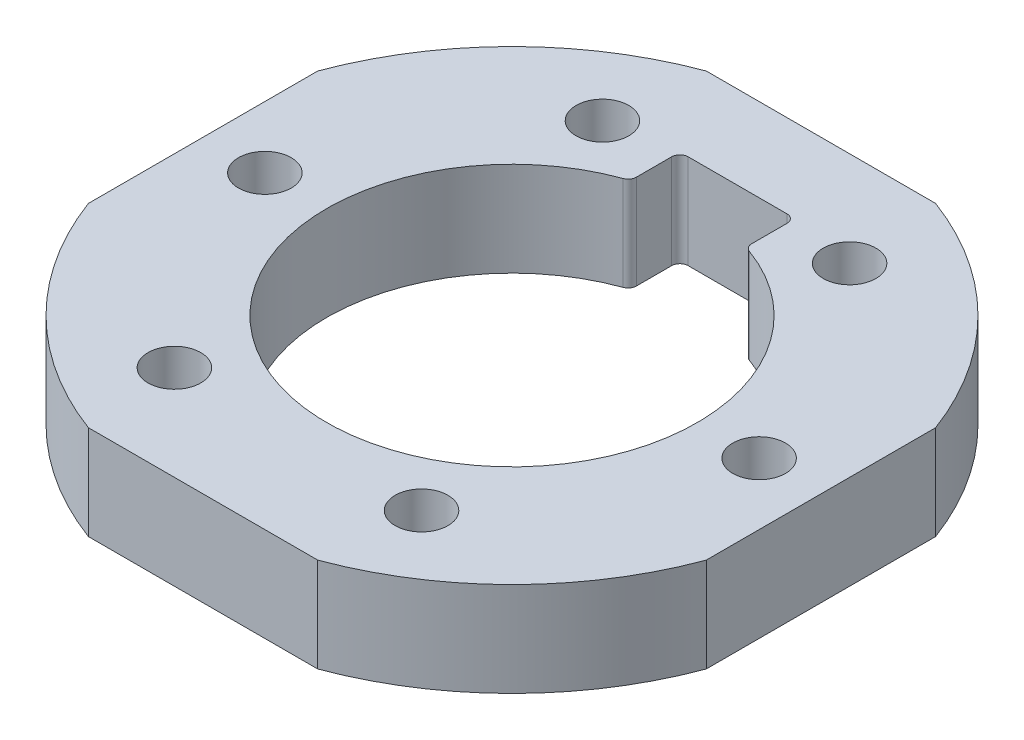
from build123d import *

# Parameters (mm, degrees)
BOSS_EXTRUDE1_DEPTH  = 11.45
M6_CLEARANCE_HOLE1_D = 6.4
FILLET1_R            = 1


with BuildPart() as part:
    # Sketch1 → Boss-Extrude1 (new body)
    with BuildSketch(Plane(origin=(0, 0, 0), x_dir=(1, 0, 0), z_dir=(0, 1, 0))):
        with BuildLine():
            Line((13.919410907, 37.5), (-13.919410907, 37.5))
            ThreePointArc((-13.919410907, 37.5), (-28.284271247, 28.284271247), (-37.5, 13.919410907))
            Line((-37.5, 13.919410907), (-37.5, -13.919410907))
            ThreePointArc((-37.5, -13.919410907), (-28.284271247, -28.284271247), (-13.919410907, -37.5))
            Line((-13.919410907, -37.5), (13.919410907, -37.5))
            ThreePointArc((13.919410907, -37.5), (28.284271247, -28.284271247), (37.5, -13.919410907))
            Line((37.5, -13.919410907), (37.5, 13.919410907))
            ThreePointArc((37.5, 13.919410907), (28.284271247, 28.284271247), (13.919410907, 37.5))
        make_face()
        with BuildLine():
            ThreePointArc((22.5, 0), (-13.205112646, -18.217436702), (-7, 21.38340478))
            Line((-7, 21.38340478), (-7, 27.38340478))
            Line((-7, 27.38340478), (7, 27.38340478))
            Line((7, 27.38340478), (7, 21.38340478))
            ThreePointArc((7, 21.38340478), (18.217436702, 13.205112646), (22.5, 0))
        make_face(mode=Mode.SUBTRACT)
    extrude(amount=-BOSS_EXTRUDE1_DEPTH)

    # M6 Clearance Hole1 (through all)
    with Locations(Plane(origin=(-30, 0, 0), x_dir=(0, 0, 1), z_dir=(0, 1, 0))):
        with Locations((0, 0), (-25.980762114, 15), (-25.980762114, 45), (0, 60), (25.980762114, 45), (25.980762114, 15)):
            Hole(M6_CLEARANCE_HOLE1_D / 2)

    # Fillet1
    fillet1_edges = [part.edges().sort_by_distance(p)[0] for p in [
        (7, -5.725, -21.38340478),
        (7, -5.725, -27.38340478),
        (-7, -5.725, -27.38340478),
        (-7, -5.725, -21.38340478),
    ]]
    fillet(fillet1_edges, radius=FILLET1_R)


solid = part.part
